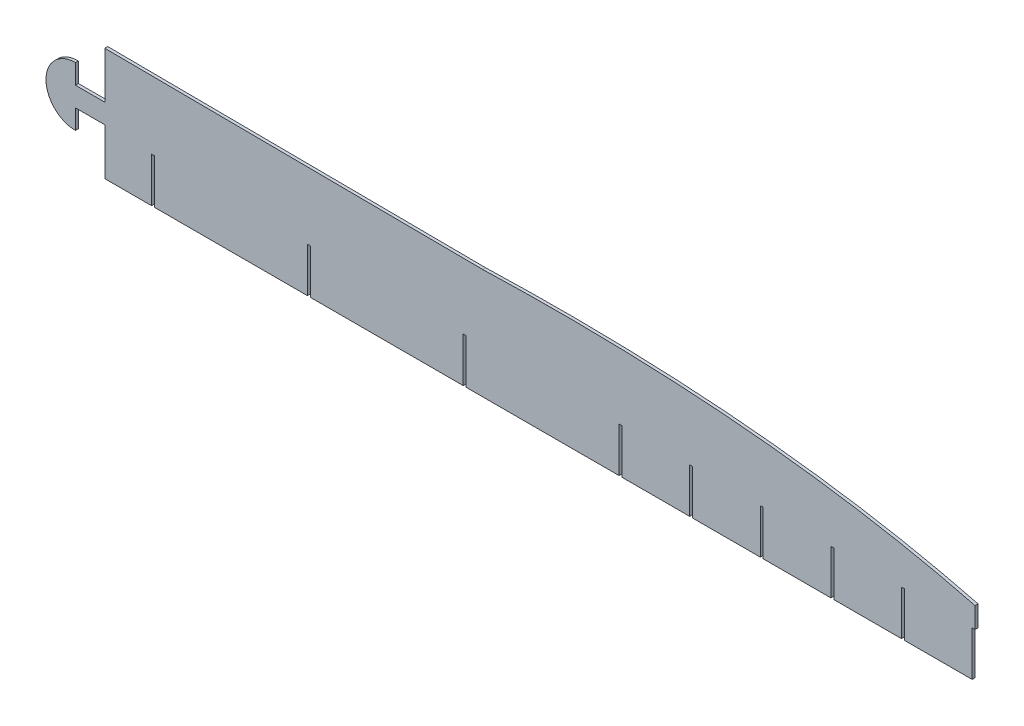
from build123d import *

# Parameters (mm, degrees)
BOSS_EXTRUDE1_DEPTH = 3


with BuildPart() as part:
    # Model → Boss-Extrude1 (new body)
    with BuildSketch(Plane.XY):
        with BuildLine():
            Line((1160.2, 315.679561973), (1160.2, 268.052661621))
            Line((1160.2, 268.052661621), (1130.2, 268.052661621))
            Line((1130.2, 268.052661621), (1130.2, 288.052661621))
            ThreePointArc((1130.2, 288.052661621), (1100.2, 258.052661621), (1130.2, 228.052661621))
            Line((1130.2, 228.052661621), (1130.2, 248.052661621))
            Line((1130.2, 248.052661621), (1160.2, 248.052661621))
            Line((1160.2, 248.052661621), (1160.2, 200.422661621))
            Line((1160.2, 200.422661621), (1207.901037796, 200.422661621))
            Line((1207.901037796, 200.422661621), (1207.901037796, 245.979700014))
            Line((1207.901037796, 245.979700014), (1210.901037796, 245.979700014))
            Line((1210.901037796, 245.979700014), (1210.901037796, 200.422661621))
            Line((1210.901037796, 200.422661621), (1366.901037796, 200.422661621))
            Line((1366.901037796, 200.422661621), (1366.901037796, 245.979700014))
            Line((1366.901037796, 245.979700014), (1369.901037796, 245.979700014))
            Line((1369.901037796, 245.979700014), (1369.901037796, 200.422661621))
            Line((1369.901037796, 200.422661621), (1525.901037796, 200.422661621))
            Line((1525.901037796, 200.422661621), (1525.901037796, 245.979700014))
            Line((1525.901037796, 245.979700014), (1528.901037796, 245.979700014))
            Line((1528.901037796, 245.979700014), (1528.901037796, 200.422661621))
            Line((1528.901037796, 200.422661621), (1684.901037797, 200.422661621))
            Line((1684.901037797, 200.422661621), (1684.901037797, 245.979700014))
            Line((1684.901037797, 245.979700014), (1687.901037796, 245.979700014))
            Line((1687.901037796, 245.979700014), (1687.901037796, 200.422661621))
            Line((1687.901037796, 200.422661621), (1756.943542985, 200.422661621))
            Line((1756.943542985, 200.422661621), (1756.943542985, 245.979700014))
            Line((1756.943542985, 245.979700014), (1759.943542985, 245.979700014))
            Line((1759.943542985, 245.979700014), (1759.943542985, 200.422661621))
            Line((1759.943542985, 200.422661621), (1828.986048174, 200.422661621))
            Line((1828.986048174, 200.422661621), (1828.986048174, 245.979700014))
            Line((1828.986048174, 245.979700014), (1831.986048174, 245.979700014))
            Line((1831.986048174, 245.979700014), (1831.986048174, 200.422661621))
            Line((1831.986048174, 200.422661621), (1901.028553363, 200.422661621))
            Line((1901.028553363, 200.422661621), (1901.028553363, 245.979700014))
            Line((1901.028553363, 245.979700014), (1904.028553363, 245.979700014))
            Line((1904.028553363, 245.979700014), (1904.028553363, 200.422661621))
            Line((1904.028553363, 200.422661621), (1973.071058552, 200.422661621))
            Line((1973.071058552, 200.422661621), (1973.071058552, 245.979700014))
            Line((1973.071058552, 245.979700014), (1976.071058559, 245.979700014))
            Line((1976.071058559, 245.979700014), (1976.071058559, 200.422661621))
            Line((1976.071058559, 200.422661621), (2045.113563741, 200.422661621))
            Line((2045.113563741, 200.422661621), (2045.113563741, 245.979700014))
            Line((2045.113563741, 245.979700014), (2048.11356374, 245.979700014))
            Line((2048.11356374, 245.979700014), (2048.11356374, 267.236738408))
            add(Edge.make_bspline(
                [(2048.11356374, 267.236738408), (1921.116123258, 299.875981212), (1758.376470444, 319.638055471), (1545.730966639, 313)],
                knots=[0.571508356, 0.571508356, 0.571508356, 0.571508356, 1, 1, 1, 1], degree=3))
            add(Edge.make_bspline(
                [(1545.730966639, 313), (1417.219843743, 313.786784414), (1288.709572245, 314.686711242), (1160.2, 315.679561973)],
                knots=[0, 0, 0, 0, 1, 1, 1, 1], degree=3))
        make_face()
    extrude(amount=BOSS_EXTRUDE1_DEPTH)


solid = part.part
